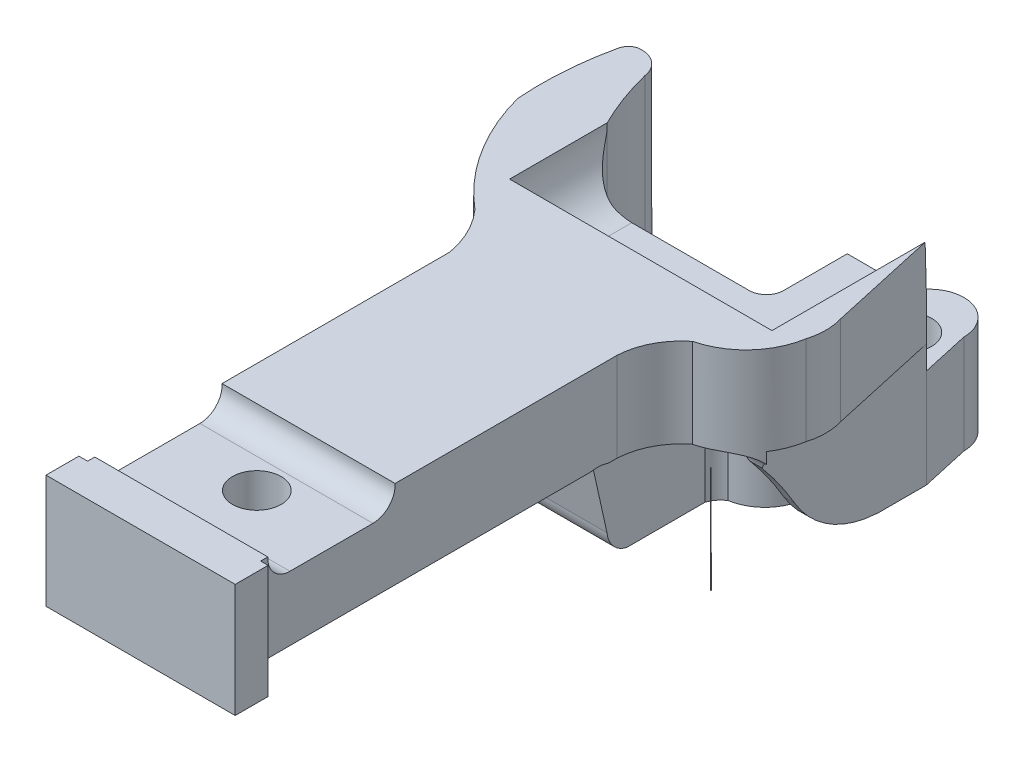
from build123d import *

# Parameters (mm, degrees)
BOSS_EXTRUDE1_DEPTH      = 431.8
CUT_EXTRUDE1_DEPTH       = 190.5
CUT_EXTRUDE1_DEPTH_BACK  = 190.5
CUT_EXTRUDE2_DEPTH       = 125.73
CUT_EXTRUDE4_DEPTH       = 128.27
CUT_EXTRUDE4_DEPTH_BACK  = 120.65
CUT_EXTRUDE5_DEPTH       = 125.73
CUT_EXTRUDE7_DEPTH       = 161.29
CUT_EXTRUDE8_DEPTH       = 45.72
CUT_EXTRUDE9_DEPTH       = 104.14
CUT_EXTRUDE9_DEPTH_BACK  = 88.9
SKETCH12_R               = 25
CUT_EXTRUDE10_DEPTH      = 431.8
CUT_EXTRUDE11_DEPTH      = 76.2
CUT_EXTRUDE11_DEPTH_BACK = 88.9
SCALE1_SCALE             = 0.05
CUT_EXTRUDE14_DEPTH      = 10
CUT_EXTRUDE14_DEPTH_BACK = 80
SKETCH17_R               = 1.25
CUT_EXTRUDE16_DEPTH      = 10


with BuildPart() as part:
    # Sketch2 → Boss-Extrude1 (new body)
    with BuildSketch(Plane(origin=(0, 0, 0), x_dir=(1, 0, 0), z_dir=(0, 1, 0))):
        with BuildLine():
            Line((-79.244298522, 0), (55.440912384, 0))
            ThreePointArc((55.440912384, 0), (68.327741041, 4.288291197), (74.467971072, 16.4026368))
            Line((74.467971072, 16.4026368), (74.467971072, 72.827707392))
            Line((74.467971072, 72.827707392), (74.467971072, 132.581872657))
            ThreePointArc((74.467971072, 132.581872657), (109.746022134, 167.859923719), (145.024073196, 132.581872657))
            Line((145.024073196, 132.581872657), (181.17312, -30.23334015))
            ThreePointArc((181.17312, -30.23334015), (183.82679773, -48.184385864), (181.17312, -66.135431578))
            ThreePointArc((181.17312, -66.135431578), (162.228077841, -104.747606276), (125.184924058, -126.602111877))
            ThreePointArc((125.184924058, -126.602111877), (106.407786564, -149.335868365), (98.730751427, -177.804582912))
            Line((98.730751427, -177.804582912), (98.730751427, -544.478753158))
            Line((98.730751427, -544.478753158), (106.407786564, -544.478753158))
            Line((106.407786564, -544.478753158), (106.407786564, -578.332354391))
            Line((106.407786564, -578.332354391), (-88.206932207, -578.332354391))
            Line((-88.206932207, -578.332354391), (-88.206932207, -544.478753158))
            Line((-88.206932207, -544.478753158), (-79.244298522, -544.478753158))
            Line((-79.244298522, -544.478753158), (-79.244298522, -171.952122102))
            ThreePointArc((-79.244298522, -171.952122102), (-88.206932207, -144.660352565), (-104.399502705, -120.933360599))
            ThreePointArc((-104.399502705, -120.933360599), (-152.176796458, -66.428157812), (-181.17312, 0))
            ThreePointArc((-181.17312, 0), (-181.323655947, 48.230174732), (-174.314101801, 95.9485))
            ThreePointArc((-174.314101801, 95.9485), (-170.720922927, 102.895856482), (-163.921391124, 106.761482404))
            ThreePointArc((-163.921391124, 106.761482404), (-145.58136446, 101.830499971), (-136.054979803, 85.401283278))
            ThreePointArc((-136.054979803, 85.401283278), (-126.311948352, 53.883000562), (-113.17819392, 23.620262719))
            ThreePointArc((-113.17819392, 23.620262719), (-99.916901574, 6.486425919), (-79.244298522, 0))
        make_face()
    extrude(amount=BOSS_EXTRUDE1_DEPTH)

    # Sketch3 → Cut-Extrude1 (cut, two sides: drawn at the far end of the back side and taken through both)
    with BuildSketch(Plane(origin=(0, 0, 0), x_dir=(0, 0, -1), z_dir=(1, 0, 0)).offset(-CUT_EXTRUDE1_DEPTH_BACK)):
        with BuildLine():
            Line((-204.28108922, 127), (-544.478753158, 127))
            Line((-544.478753158, 127), (-544.478753158, 100.52839733))
            Line((-544.478753158, 100.52839733), (-578.332354391, 100.52839733))
            Line((-578.332354391, 100.52839733), (-578.332354391, 0))
            Line((-578.332354391, 0), (-126.602111877, 0))
            ThreePointArc((-126.602111877, 0), (-140.566602846, 8.233208943), (-146.973522261, 23.12428416))
            Line((-146.973522261, 23.12428416), (-164.165792349, 100.52839733))
            ThreePointArc((-164.165792349, 100.52839733), (-178.868176776, 121.87961231), (-204.28108922, 127))
        make_face()
        with BuildLine():
            Line((-204.28108922, 304.8), (-544.478753158, 304.8))
            Line((-544.478753158, 304.8), (-544.478753158, 331.668917397))
            Line((-544.478753158, 331.668917397), (-578.332354391, 331.668917397))
            Line((-578.332354391, 331.668917397), (-578.332354391, 431.8))
            Line((-578.332354391, 431.8), (-126.602111877, 431.8))
            ThreePointArc((-126.602111877, 431.8), (-140.684053109, 425.838191425), (-146.973522261, 411.89951114))
            Line((-146.973522261, 411.89951114), (-164.165792349, 331.668917397))
            ThreePointArc((-164.165792349, 331.668917397), (-181.197219127, 313.716309403), (-204.28108922, 304.8))
        make_face()
    extrude(amount=CUT_EXTRUDE1_DEPTH + CUT_EXTRUDE1_DEPTH_BACK, mode=Mode.SUBTRACT)

    # Sketch4 → Cut-Extrude2 (cut)
    with BuildSketch(Plane(origin=(0, 431.8, 0), x_dir=(1, 0, 0), z_dir=(0, 1, 0))):
        Polygon((155.84555549, -87.211031478), (155.84555549, 83.841944542), (226.394952987, -1.684543468), (177.876923144, -101.374053541), align=None)
        with BuildLine():
            Line((57.318052164, -164.165792349), (57.318052164, -47.130284905))
            ThreePointArc((57.318052164, -47.130284905), (61.348404683, -39.477358819), (67.773769346, -33.687219957))
            ThreePointArc((67.773769346, -33.687219957), (94.808127688, -18.527489601), (106.050536967, 10.356453845))
            Line((106.050536967, 10.356453845), (130.534952263, 10.356453845))
            ThreePointArc((130.534952263, 10.356453845), (138.616208532, 6.545433697), (144.697974326, 0))
            Line((144.697974326, 0), (144.697974326, -87.211031478))
            Line((144.697974326, -87.211031478), (138.616208532, -92.687338339))
            Line((138.616208532, -92.687338339), (138.616208532, -164.165792349))
            Line((138.616208532, -164.165792349), (138.616208532, -204.28108922))
            Line((138.616208532, -204.28108922), (57.318052164, -204.28108922))
            Line((57.318052164, -204.28108922), (57.318052164, -164.165792349))
        make_face()
        with BuildLine():
            Line((-174.314101801, 95.9485), (-160.803012267, 93.363428502))
            ThreePointArc((-160.803012267, 93.363428502), (-150.960378938, 80.465137541), (-146.941851349, 64.745888939))
            ThreePointArc((-146.941851349, 64.745888939), (-140.774296617, 37.783553429), (-131.885618608, 11.591996185))
            ThreePointArc((-131.885618608, 11.591996185), (-111.728690537, -11.869907513), (-84.566029991, -26.666952706))
            ThreePointArc((-84.566029991, -26.666952706), (-71.496208015, -37.684459203), (-67.501620029, -54.305198138))
            Line((-67.501620029, -54.305198138), (-67.501620029, -164.165792349))
            Line((-67.501620029, -164.165792349), (-67.501620029, -204.28108922))
            Line((-67.501620029, -204.28108922), (-94.807796549, -204.28108922))
            Line((-94.807796549, -204.28108922), (-106.074933908, -164.165792349))
            Line((-106.074933908, -164.165792349), (-212.544008295, 0))
            Line((-212.544008295, 0), (-212.544008295, 95.9485))
            Line((-212.544008295, 95.9485), (-174.314101801, 95.9485))
        make_face()
    extrude(amount=-CUT_EXTRUDE2_DEPTH, mode=Mode.SUBTRACT)

    # Sketch6 → Cut-Extrude4 (cut, two sides: drawn at the far end of the back side and taken through both)
    with BuildSketch(Plane.XY.offset(-CUT_EXTRUDE4_DEPTH_BACK)):
        with BuildLine():
            Line((-181.17312, 306.07), (-200.286673994, 306.07))
            Line((-200.286673994, 306.07), (-200.286673994, 431.8))
            Line((-200.286673994, 431.8), (-84.566029991, 431.8))
            ThreePointArc((-84.566029991, 431.8), (-123.973907642, 408.523503999), (-146.941851349, 368.935))
            ThreePointArc((-146.941851349, 368.935), (-151.793508278, 351.084070168), (-160.803012267, 334.927860566))
            ThreePointArc((-160.803012267, 334.927860566), (-168.44948447, 318.707003198), (-181.17312, 306.07))
        make_face()
        with BuildLine():
            Line((-181.17312, 126.127314727), (-200.286673994, 126.127314727))
            Line((-200.286673994, 126.127314727), (-200.286673994, 0.397314727))
            Line((-200.286673994, 0.397314727), (-200.286673994, -9.335489314))
            Line((-200.286673994, -9.335489314), (-84.566029991, -9.335489314))
            Line((-84.566029991, -9.335489314), (-84.566029991, 0.397314727))
            ThreePointArc((-84.566029991, 0.397314727), (-123.973907642, 23.673810728), (-146.941851349, 63.262314727))
            ThreePointArc((-146.941851349, 63.262314727), (-151.793508278, 81.113244559), (-160.803012267, 97.26945416))
            ThreePointArc((-160.803012267, 97.26945416), (-168.44948447, 113.490311529), (-181.17312, 126.127314727))
        make_face()
    extrude(amount=CUT_EXTRUDE4_DEPTH + CUT_EXTRUDE4_DEPTH_BACK, mode=Mode.SUBTRACT)

    # Sketch7 → Cut-Extrude5 (cut)
    with BuildSketch(Plane(origin=(0, 0, 0), x_dir=(1, 0, 0), z_dir=(0, 1, 0))):
        Polygon((156.049496363, -86.308866012), (156.049496363, 84.744110008), (226.598893859, -0.782378002), (178.080864016, -100.471888075), align=None)
        with BuildLine():
            Line((57.521993037, -163.263626883), (57.521993037, -46.228119439))
            ThreePointArc((57.521993037, -46.228119439), (61.552345555, -38.575193353), (67.977710219, -32.785054491))
            ThreePointArc((67.977710219, -32.785054491), (95.01206856, -17.625324135), (106.25447784, 11.258619311))
            Line((106.25447784, 11.258619311), (130.738893135, 11.258619311))
            ThreePointArc((130.738893135, 11.258619311), (138.820149404, 7.447599163), (144.901915198, 0.902165466))
            Line((144.901915198, 0.902165466), (144.901915198, -86.308866012))
            Line((144.901915198, -86.308866012), (138.820149404, -91.785172873))
            Line((138.820149404, -91.785172873), (138.820149404, -163.263626883))
            Line((138.820149404, -163.263626883), (138.820149404, -203.378923754))
            Line((138.820149404, -203.378923754), (57.521993037, -203.378923754))
            Line((57.521993037, -203.378923754), (57.521993037, -163.263626883))
        make_face()
        with BuildLine():
            Line((-174.110160928, 96.850665466), (-160.599071394, 94.265593968))
            ThreePointArc((-160.599071394, 94.265593968), (-150.756438066, 81.367303007), (-146.737910477, 65.648054405))
            ThreePointArc((-146.737910477, 65.648054405), (-140.570355744, 38.685718895), (-131.681677735, 12.494161651))
            ThreePointArc((-131.681677735, 12.494161651), (-111.524749665, -10.967742047), (-84.362089119, -25.76478724))
            ThreePointArc((-84.362089119, -25.76478724), (-71.292267142, -36.782293737), (-67.297679156, -53.403032672))
            Line((-67.297679156, -53.403032672), (-67.297679156, -163.263626883))
            Line((-67.297679156, -163.263626883), (-67.297679156, -203.378923754))
            Line((-67.297679156, -203.378923754), (-94.603855676, -203.378923754))
            Line((-94.603855676, -203.378923754), (-105.870993035, -163.263626883))
            Line((-105.870993035, -163.263626883), (-212.340067422, 0.902165466))
            Line((-212.340067422, 0.902165466), (-212.340067422, 96.850665466))
            Line((-212.340067422, 96.850665466), (-174.110160928, 96.850665466))
        make_face()
    extrude(amount=CUT_EXTRUDE5_DEPTH, mode=Mode.SUBTRACT)

    # Sketch8 → Cut-Extrude7 (cut)
    with BuildSketch(Plane(origin=(0, 0, 0), x_dir=(0, 0, -1), z_dir=(1, 0, 0))):
        Polygon((167.859923719, 215.9), (167.859923719, 101.6), (82.923395382, 101.6), (83.841944542, 330.2), (167.859923719, 330.2), align=None)
    extrude(amount=CUT_EXTRUDE7_DEPTH, mode=Mode.SUBTRACT)

    # Sketch9 → Cut-Extrude8 (cut)
    with BuildSketch(Plane(origin=(177.8, 0, 0), x_dir=(0, 0, -1), z_dir=(1, 0, 0))):
        with BuildLine():
            Line((31.13006407, 431.8), (31.13006407, 493.405620114))
            Line((31.13006407, 493.405620114), (-121.748062484, 493.405620114))
            Line((-121.748062484, 493.405620114), (-121.892848155, 306.07))
            ThreePointArc((-121.892848155, 306.07), (-100.412110743, 313.016001375), (-87.211031478, 331.329944727))
            ThreePointArc((-87.211031478, 331.329944727), (-68.814678471, 355.183985364), (-52.549790031, 380.539348952))
            ThreePointArc((-52.549790031, 380.539348952), (-17.173940566, 416.721882811), (31.13006407, 431.8))
        make_face()
        with BuildLine():
            Line((-121.360940458, -61.527139811), (-121.767097148, 125.808095964))
            ThreePointArc((-121.767097148, 125.808095964), (-100.276689563, 118.892071333), (-87.050071484, 100.596563986))
            ThreePointArc((-87.050071484, 100.596563986), (-68.62045516, 76.768213208), (-52.320206679, 51.435567114))
            ThreePointArc((-52.320206679, 51.435567114), (-16.893909677, 15.302424951), (31.431084974, 0.291716314))
            Line((31.431084974, 0.291716314), (31.517037301, -61.313843839))
            Line((31.517037301, -61.313843839), (-121.360940458, -61.527139811))
        make_face()
    extrude(amount=-CUT_EXTRUDE8_DEPTH, mode=Mode.SUBTRACT)


with BuildPart() as cut_extrude8_piece_1:
    # of the separate pieces the step leaves, piece 1, a body of its own (cut_extrude8_pieces)
    add(part.part.solids().sort_by_distance((-113.17819392, 14.385260939, -23.620262719))[0])

    # Sketch10 → Cut-Extrude9 (cut, two sides: drawn at the far end of the back side and taken through both)
    with BuildSketch(Plane(origin=(0, 0, 0), x_dir=(0, 0, -1), z_dir=(1, 0, 0)).offset(-CUT_EXTRUDE9_DEPTH_BACK)):
        with BuildLine():
            Line((-428.983201738, 193.229592666), (-514.334244368, 193.275834301))
            ThreePointArc((-514.334244368, 193.275834301), (-537.128372855, 216.094675062), (-514.309532095, 238.888803549))
            Line((-514.309532095, 238.888803549), (-428.958489465, 238.842561914))
            ThreePointArc((-428.958489465, 238.842561914), (-406.164360977, 216.023721154), (-428.983201738, 193.229592666))
        make_face()
    extrude(amount=CUT_EXTRUDE9_DEPTH + CUT_EXTRUDE9_DEPTH_BACK, mode=Mode.SUBTRACT)

    # Sketch12 → Cut-Extrude10 (cut)
    with BuildSketch(Plane(origin=(0, 0, 0), x_dir=(1, 0, 0), z_dir=(0, 1, 0))):
        with Locations(Location((111.812353192, 107.656197962, 0), (0, 0, 270))):
            Circle(SKETCH12_R)
    extrude(amount=CUT_EXTRUDE10_DEPTH, mode=Mode.SUBTRACT)

    # Sketch13 → Cut-Extrude11 (cut, two sides: drawn at the far end of the back side and taken through both)
    with BuildSketch(Plane.XY.offset(-CUT_EXTRUDE11_DEPTH_BACK)):
        with BuildLine():
            Line((156.793476245, 266.763254357), (-63.998127701, 266.763254357))
            ThreePointArc((-63.998127701, 266.763254357), (-113.494417347, 215.963254357), (-63.998127701, 165.163254357))
            Line((-63.998127701, 165.163254357), (155.992789689, 165.163254357))
            Line((155.992789689, 165.163254357), (156.793476245, 266.763254357))
        make_face()
    extrude(amount=CUT_EXTRUDE11_DEPTH + CUT_EXTRUDE11_DEPTH_BACK, mode=Mode.SUBTRACT)


with BuildPart() as cut_extrude8_piece_2:
    # of the separate pieces the step leaves, piece 2, a body of its own (cut_extrude8_pieces)
    add(part.part.solids().sort_by_distance((138.825981411, 431.8, 121.795675485))[0])


with BuildPart() as cut_extrude8_piece_1_1:
    # Scale1: scaled about (0, 0, 0)
    add(cut_extrude8_piece_1.part.scale(SCALE1_SCALE))


with BuildPart() as cut_extrude8_piece_2_1:
    # Scale1: scaled about (0, 0, 0)
    add(cut_extrude8_piece_2.part.scale(SCALE1_SCALE))


with BuildPart() as cut_extrude14_tool:
    # Sketch15 → Cut-Extrude14 (new, two sides: drawn at the far end of the back side and taken through both)
    with BuildSketch(Plane.XY.offset(28.91661772).offset(-CUT_EXTRUDE14_DEPTH_BACK)):
        Polygon((-19.41034661, 10.869789513), (25.58965339, 10.869789513), (25.58965339, 45.642776715), (-19.41034661, 47.662845319), align=None)
    extrude(amount=CUT_EXTRUDE14_DEPTH + CUT_EXTRUDE14_DEPTH_BACK)


with BuildPart() as cut_extrude8_piece_1_2:
    add(cut_extrude8_piece_1_1.part)

    # Cut-Extrude14: cut by cut_extrude14_tool
    add(cut_extrude14_tool.part, mode=Mode.SUBTRACT)

    # Sketch17 → Cut-Extrude16 (cut)
    with BuildSketch(Plane.XZ.offset(-6.35)):
        with Locations(Location((0.487161323, 22.971466859, 0), (0, 0, 270))):
            Circle(SKETCH17_R)
    extrude(amount=-CUT_EXTRUDE16_DEPTH, mode=Mode.SUBTRACT)


with BuildPart() as cut_extrude8_piece_2_2:
    add(cut_extrude8_piece_2_1.part)

    # Cut-Extrude14: cut by cut_extrude14_tool
    add(cut_extrude14_tool.part, mode=Mode.SUBTRACT)


solid = cut_extrude8_piece_1_2.part
